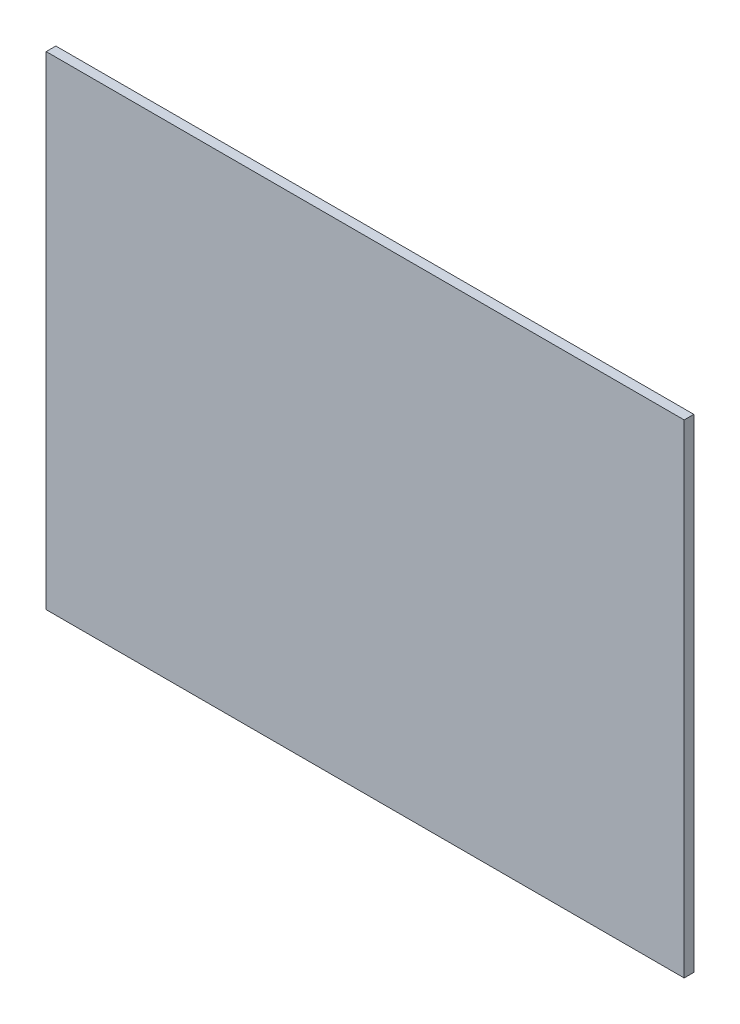
from build123d import *

# Parameters (mm, degrees)
SKIZZE1_W                       = 66
SKIZZE1_H                       = 50
AUFSATZ_LINEAR_AUSTRAGEN2_DEPTH = 1


with BuildPart() as part:
    # Skizze1 → Aufsatz-Linear austragen2 (new body)
    with BuildSketch(Plane.XY):
        Rectangle(SKIZZE1_W, SKIZZE1_H)
    extrude(amount=AUFSATZ_LINEAR_AUSTRAGEN2_DEPTH)


solid = part.part
